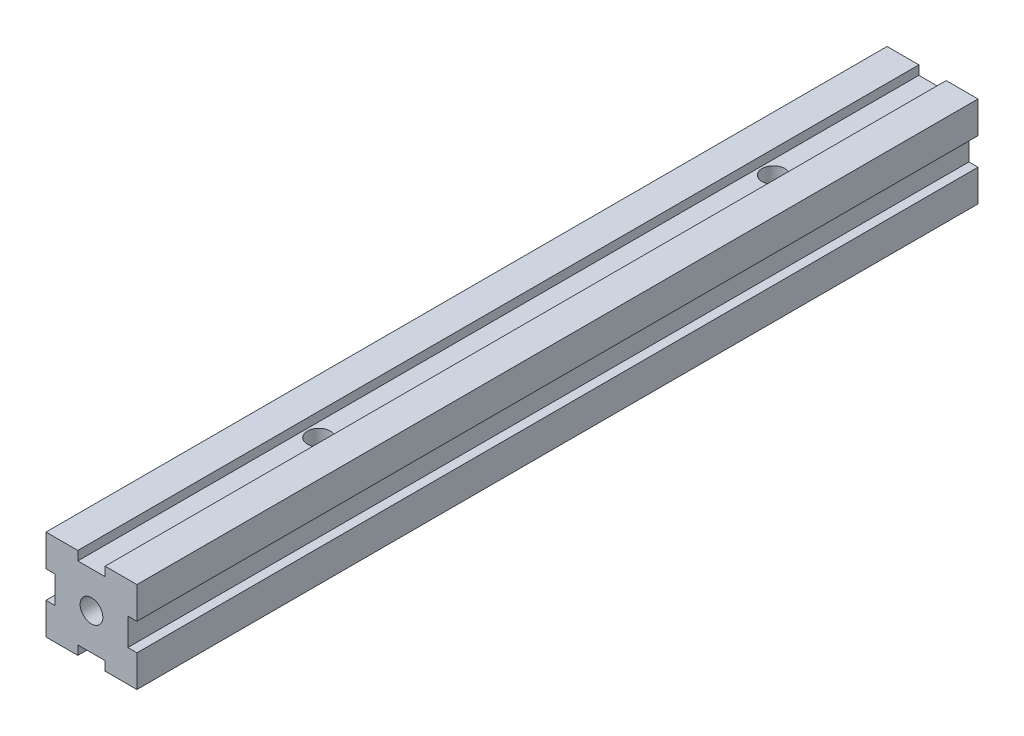
from build123d import *

# Parameters (mm, degrees)
SKETCH_1_R          = 2.5
EXTRUDE_1_DEPTH     = 185
SKETCH_2_R          = 2.5
CUT_EXTRUDE_1_DEPTH = 188.149672722


with BuildPart() as part:
    # 草图1 → 凸台-拉伸1 (new body)
    with BuildSketch(Plane.XY):
        Polygon((0, -13), (0, -20), (7, -20), (7, -18), (13, -18), (13, -20), (20, -20), (20, -13), (18, -13), (18, -7), (20, -7), (20, 0), (13, 0), (13, -2), (7, -2), (7, 0), (0, 0), (0, -7), (2, -7), (2, -13), align=None)
        with Locations((10, -10)):
            Circle(SKETCH_1_R, mode=Mode.SUBTRACT)
    extrude(amount=EXTRUDE_1_DEPTH)

    # 草图2 → 切除-拉伸1 (cut, through all)
    with BuildSketch(Plane(origin=(0, 0, 0), x_dir=(1, 0, 0), z_dir=(0, 1, 0))):
        with Locations(Location((10, -35, 0), (0, 0, 270))):
            Circle(SKETCH_2_R)
        with Locations(Location((10, -135, 0), (0, 0, 270))):
            Circle(SKETCH_2_R)
    extrude(amount=-CUT_EXTRUDE_1_DEPTH, mode=Mode.SUBTRACT)


solid = part.part
